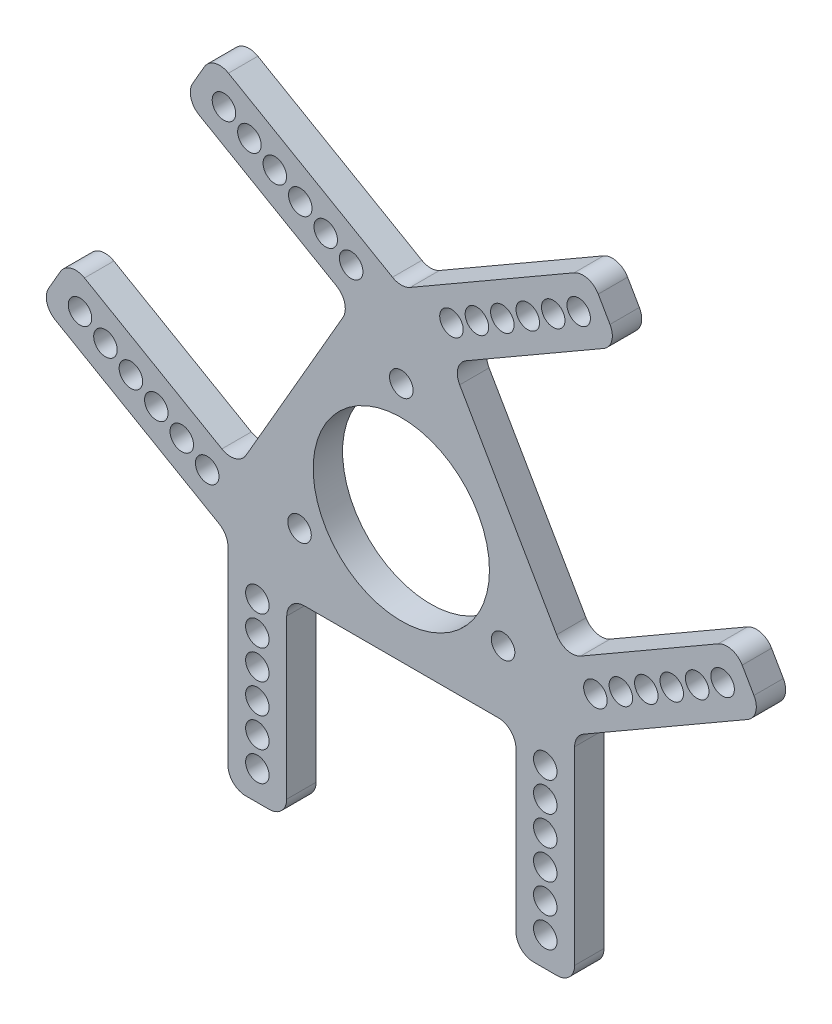
from build123d import *

# Parameters (mm, degrees)
SKETCH1_R           = 2
SKETCH1_R_2         = 15
BOSS_EXTRUDE1_DEPTH = 5
FILLET1_R           = 3


with BuildPart() as part:
    # Sketch1 → Boss-Extrude1 (new body)
    with BuildSketch(Plane.XY):
        Polygon((-19.5, -21), (19.5, -21), (19.5, -54), (29.5, -54), (29.5, -17.031832941), (61.515371804, 1.452250588), (56.515371804, 10.112504626), (27.936533479, -6.387495374), (8.436533479, 27.387495374), (37.015371804, 43.887495374), (32.015371804, 52.547749412), (0, 34.063665882), (-32.015371804, 52.547749412), (-37.015371804, 43.887495374), (-8.436533479, 27.387495374), (-27.936533479, -6.387495374), (-56.515371804, 10.112504626), (-61.515371804, 1.452250588), (-29.5, -17.031832941), (-29.5, -54), (-19.5, -54), align=None)
        with Locations((24.5, -24)):
            Circle(SKETCH1_R, mode=Mode.SUBTRACT)
        with Locations((24.5, -29)):
            Circle(SKETCH1_R, mode=Mode.SUBTRACT)
        with Locations((24.5, -34)):
            Circle(SKETCH1_R, mode=Mode.SUBTRACT)
        with Locations((24.5, -39)):
            Circle(SKETCH1_R, mode=Mode.SUBTRACT)
        with Locations((24.5, -44)):
            Circle(SKETCH1_R, mode=Mode.SUBTRACT)
        with Locations((24.5, -49)):
            Circle(SKETCH1_R, mode=Mode.SUBTRACT)
        with Locations(Location((-24.5, -49, 0), (0, 0, 180))):
            Circle(SKETCH1_R, mode=Mode.SUBTRACT)
        with Locations(Location((-24.5, -44, 0), (0, 0, 180))):
            Circle(SKETCH1_R, mode=Mode.SUBTRACT)
        with Locations(Location((-24.5, -39, 0), (0, 0, 180))):
            Circle(SKETCH1_R, mode=Mode.SUBTRACT)
        with Locations(Location((-24.5, -34, 0), (0, 0, 180))):
            Circle(SKETCH1_R, mode=Mode.SUBTRACT)
        with Locations(Location((-24.5, -29, 0), (0, 0, 180))):
            Circle(SKETCH1_R, mode=Mode.SUBTRACT)
        with Locations(Location((-24.5, -24, 0), (0, 0, 180))):
            Circle(SKETCH1_R, mode=Mode.SUBTRACT)
        with Locations(Location((-8.534609691, 33.217622393, 0), (0, 0, 180))):
            Circle(SKETCH1_R, mode=Mode.SUBTRACT)
        with Locations(Location((-12.86473671, 35.717622393, 0), (0, 0, 180))):
            Circle(SKETCH1_R, mode=Mode.SUBTRACT)
        with Locations(Location((-17.194863729, 38.217622393, 0), (0, 0, 180))):
            Circle(SKETCH1_R, mode=Mode.SUBTRACT)
        with Locations(Location((-21.524990748, 40.717622393, 0), (0, 0, 180))):
            Circle(SKETCH1_R, mode=Mode.SUBTRACT)
        with Locations(Location((-25.855117767, 43.217622393, 0), (0, 0, 180))):
            Circle(SKETCH1_R, mode=Mode.SUBTRACT)
        with Locations(Location((-30.185244785, 45.717622393, 0), (0, 0, 180))):
            Circle(SKETCH1_R, mode=Mode.SUBTRACT)
        with Locations((-33.034609691, -9.217622393)):
            Circle(SKETCH1_R, mode=Mode.SUBTRACT)
        with Locations((-37.36473671, -6.717622393)):
            Circle(SKETCH1_R, mode=Mode.SUBTRACT)
        with Locations((-41.694863729, -4.217622393)):
            Circle(SKETCH1_R, mode=Mode.SUBTRACT)
        with Locations((-46.024990748, -1.717622393)):
            Circle(SKETCH1_R, mode=Mode.SUBTRACT)
        with Locations((-50.355117767, 0.782377607)):
            Circle(SKETCH1_R, mode=Mode.SUBTRACT)
        with Locations((-54.685244785, 3.282377607)):
            Circle(SKETCH1_R, mode=Mode.SUBTRACT)
        with Locations(Location((33.034609691, -9.217622393, 0), (0, 0, 180))):
            Circle(SKETCH1_R, mode=Mode.SUBTRACT)
        with Locations(Location((37.36473671, -6.717622393, 0), (0, 0, 180))):
            Circle(SKETCH1_R, mode=Mode.SUBTRACT)
        with Locations(Location((41.694863729, -4.217622393, 0), (0, 0, 180))):
            Circle(SKETCH1_R, mode=Mode.SUBTRACT)
        with Locations(Location((46.024990748, -1.717622393, 0), (0, 0, 180))):
            Circle(SKETCH1_R, mode=Mode.SUBTRACT)
        with Locations(Location((50.355117767, 0.782377607, 0), (0, 0, 180))):
            Circle(SKETCH1_R, mode=Mode.SUBTRACT)
        with Locations(Location((54.685244785, 3.282377607, 0), (0, 0, 180))):
            Circle(SKETCH1_R, mode=Mode.SUBTRACT)
        with Locations((8.534609691, 33.217622393)):
            Circle(SKETCH1_R, mode=Mode.SUBTRACT)
        with Locations((12.86473671, 35.717622393)):
            Circle(SKETCH1_R, mode=Mode.SUBTRACT)
        with Locations((17.194863729, 38.217622393)):
            Circle(SKETCH1_R, mode=Mode.SUBTRACT)
        with Locations((21.524990748, 40.717622393)):
            Circle(SKETCH1_R, mode=Mode.SUBTRACT)
        with Locations((25.855117767, 43.217622393)):
            Circle(SKETCH1_R, mode=Mode.SUBTRACT)
        with Locations((30.185244785, 45.717622393)):
            Circle(SKETCH1_R, mode=Mode.SUBTRACT)
        with Locations((0, 20)):
            Circle(SKETCH1_R, mode=Mode.SUBTRACT)
        with Locations((17.320508076, -10)):
            Circle(SKETCH1_R, mode=Mode.SUBTRACT)
        with Locations((-17.320508076, -10)):
            Circle(SKETCH1_R, mode=Mode.SUBTRACT)
        Circle(SKETCH1_R_2, mode=Mode.SUBTRACT)
    extrude(amount=BOSS_EXTRUDE1_DEPTH)

    # Fillet1
    fillet1_edges = [part.edges().sort_by_distance(p)[0] for p in [
        (19.5, -54, 2.5),
        (19.5, -21, 2.5),
        (-19.5, -21, 2.5),
        (-19.5, -54, 2.5),
        (-29.5, -54, 2.5),
        (-29.5, -17.031832941, 2.5),
        (-61.515371804, 1.452250588, 2.5),
        (-56.515371804, 10.112504626, 2.5),
        (-27.936533479, -6.387495374, 2.5),
        (-8.436533479, 27.387495374, 2.5),
        (-37.015371804, 43.887495374, 2.5),
        (-32.015371804, 52.547749412, 2.5),
        (0, 34.063665882, 2.5),
        (32.015371804, 52.547749412, 2.5),
        (37.015371804, 43.887495374, 2.5),
        (8.436533479, 27.387495374, 2.5),
        (27.936533479, -6.387495374, 2.5),
        (56.515371804, 10.112504626, 2.5),
        (61.515371804, 1.452250588, 2.5),
        (29.5, -17.031832941, 2.5),
        (29.5, -54, 2.5),
    ]]
    fillet(fillet1_edges, radius=FILLET1_R)


solid = part.part
